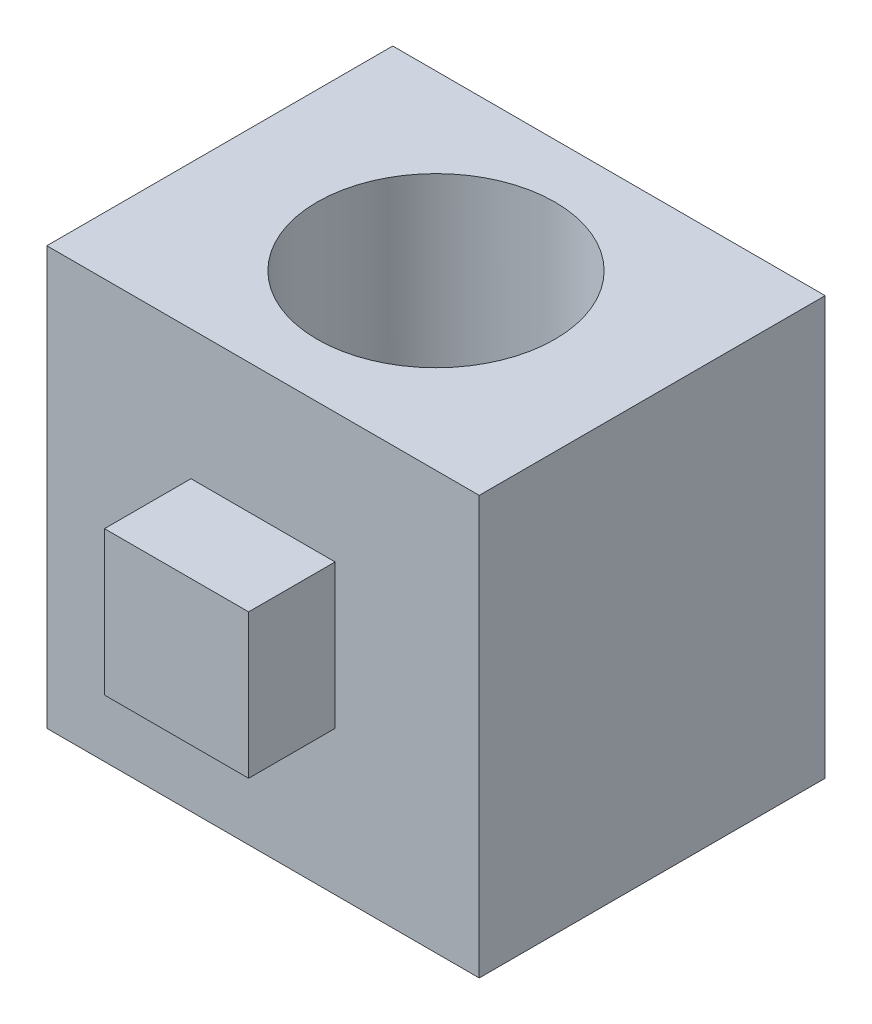
from build123d import *

# Parameters (mm, degrees)
SKETCH1_W           = 30
SKETCH1_H           = 29
BOSS_EXTRUDE1_DEPTH = 12
SKETCH2_R           = 8.25
CUT_EXTRUDE1_DEPTH  = 34
BOSS_EXTRUDE2_START = 12
SKETCH3_W           = 10
SKETCH3_H           = 10
BOSS_EXTRUDE2_DEPTH = 6


with BuildPart() as part:
    # Sketch1 → Boss-Extrude1 (new, symmetric)
    with BuildSketch(Plane.XY):
        with Locations((0, 14.5)):
            Rectangle(SKETCH1_W, SKETCH1_H)
    extrude(amount=BOSS_EXTRUDE1_DEPTH, both=True)

    # Sketch2 → Cut-Extrude1 (cut, symmetric)
    with BuildSketch(Plane(origin=(0, 0, 0), x_dir=(1, 0, 0), z_dir=(0, 1, 0))):
        with Locations(Location((0, 0, 0), (0, 0, 270))):
            Circle(SKETCH2_R)
    extrude(amount=CUT_EXTRUDE1_DEPTH, both=True, mode=Mode.SUBTRACT)

    # Sketch3 → Boss-Extrude2 (add)
    with BuildSketch(Plane.XY.offset(BOSS_EXTRUDE2_START)):
        with Locations((0, 15)):
            Rectangle(SKETCH3_W, SKETCH3_H)
    extrude(amount=BOSS_EXTRUDE2_DEPTH)


solid = part.part
